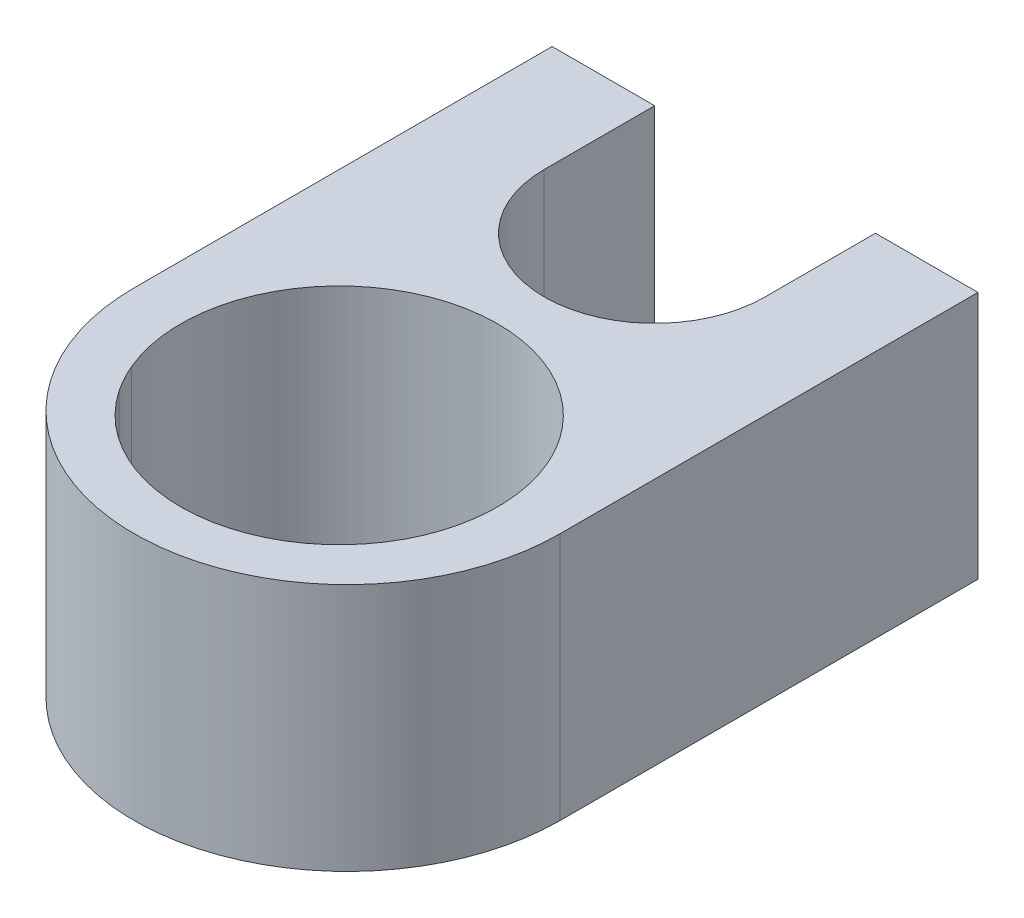
from build123d import *

# Parameters (mm, degrees)
SZKIC1_W                    = 54
SZKIC1_H                    = 31.5
DODANIE_WYCI_GNI_CIE1_DEPTH = 45
SZKIC2_W                    = 54
SZKIC2_H                    = 31.5
DODANIE_WYCI_GNI_CIE2_DEPTH = 35
WYTNIJ_WYCI_GNI_CIE3_REACH  = 63.207
ZAOKR_GLENIE1_RADIUS        = 27
ZAOKR_GLENIE1_LENGTH        = 31.5
SZKIC9_R                    = 20.1
WYTNIJ_WYCI_GNI_CIE4_DEPTH  = 62.206617289


with BuildPart() as part:
    # Szkic1 → Dodanie-wyciągnięcie1 (new body)
    with BuildSketch(Plane.XY):
        Rectangle(SZKIC1_W, SZKIC1_H)
    extrude(amount=DODANIE_WYCI_GNI_CIE1_DEPTH)

    # Szkic2 → Dodanie-wyciągnięcie2 (add)
    with BuildSketch(Plane(origin=(0, 0, 0), x_dir=(-1, 0, 0), z_dir=(0, 0, -1))):
        Rectangle(SZKIC2_W, SZKIC2_H)
    extrude(amount=DODANIE_WYCI_GNI_CIE2_DEPTH)

    # Szkic8 → Wytnij-wyciągnięcie3 (cut, up to next)
    with BuildSketch(Plane(origin=(0, 15.75, 0), x_dir=(1, 0, 0), z_dir=(0, 1, 0)), mode=Mode.PRIVATE) as wytnij_wyci_gni_cie3_sk1:
        with BuildLine():
            Line((14, 35), (-14, 35))
            Line((-14, 35), (-14, 21))
            ThreePointArc((-14, 21), (0, 7), (14, 21))
            Line((14, 21), (14, 35))
        make_face()
    wytnij_wyci_gni_cie3_tool1 = extrude(wytnij_wyci_gni_cie3_sk1.sketch, amount=-WYTNIJ_WYCI_GNI_CIE3_REACH, mode=Mode.PRIVATE) & part.part
    add(wytnij_wyci_gni_cie3_tool1.solids().sort_by_distance((0, 15.75, -22.306898))[0], mode=Mode.SUBTRACT)

    # Zaokrąglenie1: full round fillet: the end face becomes a half cylinder, R = half its width
    zaokr_glenie1_face = Plane((0, 0, 45), x_dir=(0, -1, 0), z_dir=(0, 0, 1))  # on the end face: x along it, z out of the body
    zaokr_glenie1_slab = zaokr_glenie1_face.offset(-ZAOKR_GLENIE1_RADIUS / 2) * Box(ZAOKR_GLENIE1_LENGTH, 2 * ZAOKR_GLENIE1_RADIUS, ZAOKR_GLENIE1_RADIUS, mode=Mode.PRIVATE)  # the body's end, R deep
    zaokr_glenie1_round = Plane((0, 0, 18), x_dir=(0, 0, 1), z_dir=(0, -1, 0)) * Cylinder(ZAOKR_GLENIE1_RADIUS, ZAOKR_GLENIE1_LENGTH, mode=Mode.PRIVATE)  # its axis R under the face
    add(zaokr_glenie1_slab - zaokr_glenie1_round, mode=Mode.SUBTRACT)

    # Szkic9 → Wytnij-wyciągnięcie4 (cut, through all)
    with BuildSketch(Plane(origin=(0, -15.75, 0), x_dir=(-1, 0, 0), z_dir=(0, -1, 0))):
        with Locations(Location((0, -19, 0), (0, 0, 90))):
            Circle(SZKIC9_R)
    extrude(amount=-WYTNIJ_WYCI_GNI_CIE4_DEPTH, mode=Mode.SUBTRACT)


solid = part.part
